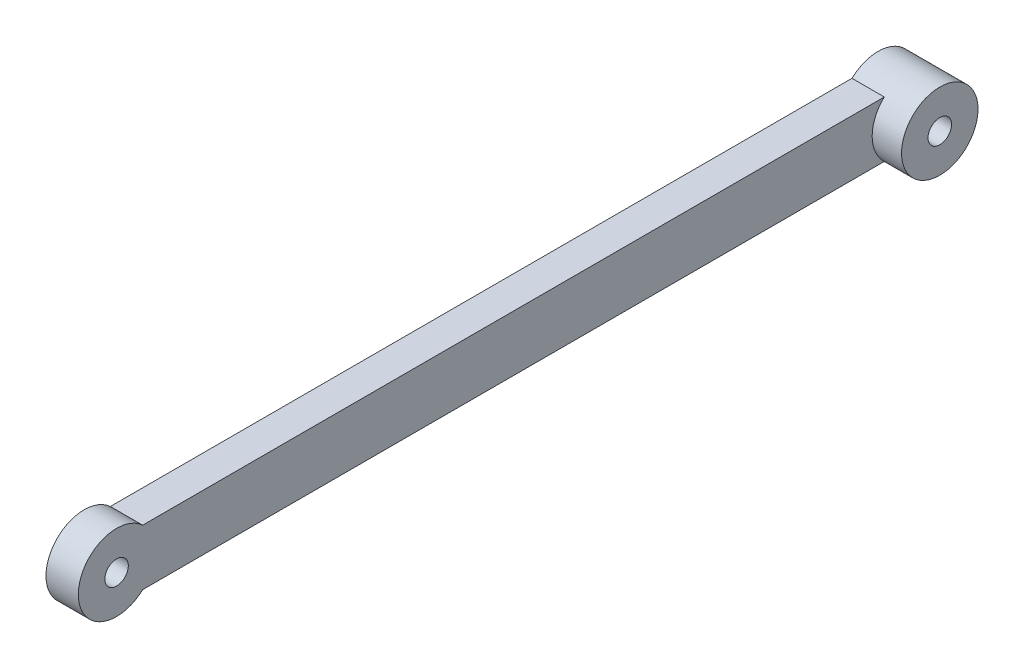
from build123d import *

# Parameters (mm, degrees)
SKETCH1_R           = 2
BOSS_EXTRUDE1_DEPTH = 5.5
SKETCH2_R           = 6.5
SKETCH2_R_2         = 2
BOSS_EXTRUDE3_DEPTH = 5


with BuildPart() as part:
    # Sketch1 → Boss-Extrude1 (new body)
    with BuildSketch(Plane(origin=(0, 0, 0), x_dir=(0, 0, -1), z_dir=(1, 0, 0))):
        with BuildLine():
            Line((4.437059837, 4.75), (130.562940163, 4.75))
            ThreePointArc((130.562940163, 4.75), (141.5, 0), (130.562940163, -4.75))
            Line((130.562940163, -4.75), (4.437059837, -4.75))
            ThreePointArc((4.437059837, -4.75), (-6.5, 0), (4.437059837, 4.75))
        make_face()
        Circle(SKETCH1_R, mode=Mode.SUBTRACT)
        with Locations((135, 0)):
            Circle(SKETCH1_R, mode=Mode.SUBTRACT)
    extrude(amount=BOSS_EXTRUDE1_DEPTH)

    # Sketch2 → Boss-Extrude3 (add)
    with BuildSketch(Plane(origin=(5.5, 0, 0), x_dir=(0, 0, -1), z_dir=(1, 0, 0))):
        with Locations(Location((135, 0, 0), (0, 0, 133.0490798))):
            Circle(SKETCH2_R)
        with Locations((135, 0)):
            Circle(SKETCH2_R_2, mode=Mode.SUBTRACT)
    extrude(amount=BOSS_EXTRUDE3_DEPTH)


solid = part.part
